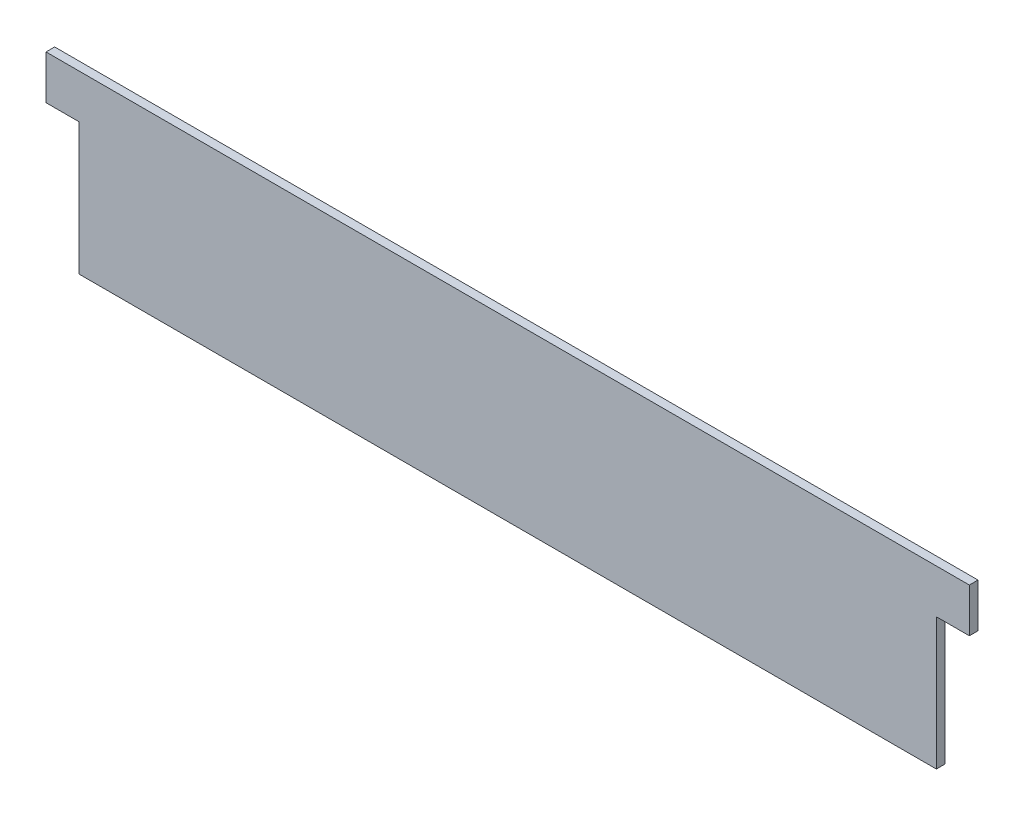
from build123d import *

# Parameters (mm, degrees)
BOSS_EXTRUDE1_DEPTH = 2.5


with BuildPart() as part:
    # Sketch1 → Boss-Extrude1 (new, symmetric)
    with BuildSketch(Plane.XY):
        Polygon((-266.7, 63.5), (266.7, 63.5), (266.7, 38.1), (247.65, 38.1), (247.65, -38.1), (-247.65, -38.1), (-247.65, 38.1), (-266.7, 38.1), align=None)
    extrude(amount=BOSS_EXTRUDE1_DEPTH, both=True)


solid = part.part
